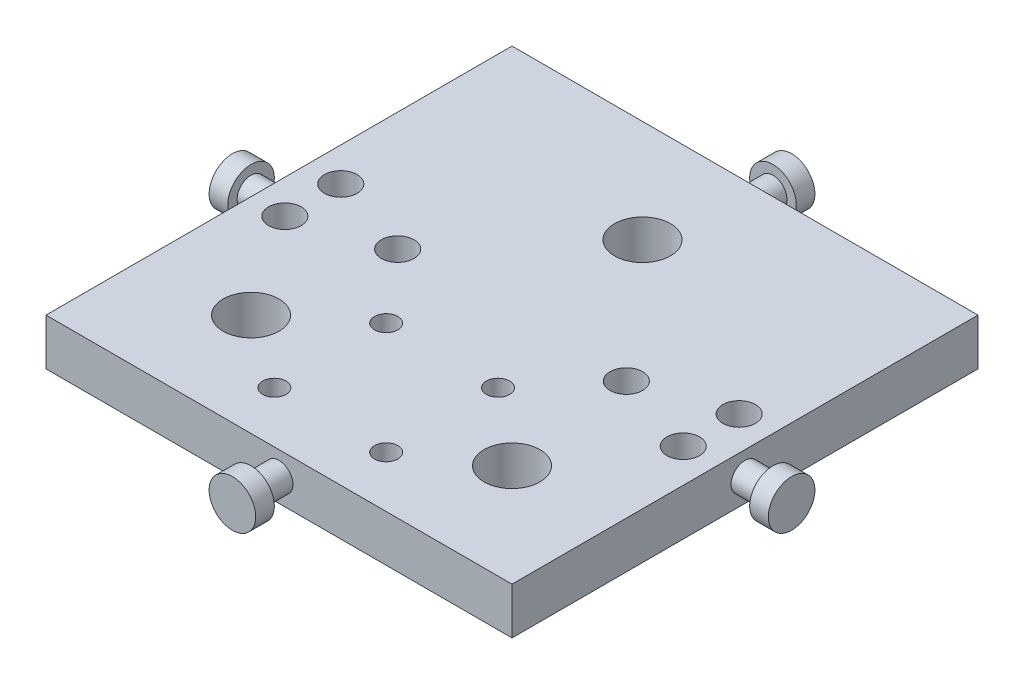
from build123d import *

# Parameters (mm, degrees)
SKETCH_1_W          = 50
SKETCH_1_H          = 50
EXTRUDE_1_DEPTH     = 5
SKETCH_2_R          = 3
CUT_EXTRUDE_1_DEPTH = 71.887234394
SKETCH_3_R          = 1.25
CUT_EXTRUDE_2_DEPTH = 71.887234394
SKETCH_8_R          = 1.75
CUT_EXTRUDE_4_DEPTH = 71.887234394
SKETCH_9_R          = 2.5
EXTRUDE_2_DEPTH     = 5
SKETCH_10_R         = 2.5
SKETCH_10_R_2       = 1.5
CUT_EXTRUDE_5_DEPTH = 3
SKETCH_11_R         = 2.5
EXTRUDE_3_DEPTH     = 5
SKETCH_12_R         = 2.5
SKETCH_12_R_2       = 1.5
CUT_EXTRUDE_7_DEPTH = 3


with BuildPart() as part:
    # 草图1 → 凸台-拉伸1 (new body)
    with BuildSketch(Plane(origin=(0, 0, 0), x_dir=(1, 0, 0), z_dir=(0, 1, 0))):
        with Locations((25, 25)):
            Rectangle(SKETCH_1_W, SKETCH_1_H)
    extrude(amount=EXTRUDE_1_DEPTH)

    # 草图2 → 切除-拉伸1 (cut, through all)
    with BuildSketch(Plane(origin=(0, 5, 0), x_dir=(1, 0, 0), z_dir=(0, 1, 0))):
        with Locations(Location((25, 39, 0), (0, 0, 270))):
            Circle(SKETCH_2_R)
        with Locations(Location((11, 11, 0), (0, 0, 270))):
            Circle(SKETCH_2_R)
        with Locations(Location((39, 11, 0), (0, 0, 270))):
            Circle(SKETCH_2_R)
    extrude(amount=-CUT_EXTRUDE_1_DEPTH, mode=Mode.SUBTRACT)

    # 草图3 → 切除-拉伸2 (cut, through all)
    with BuildSketch(Plane(origin=(0, 5, 0), x_dir=(1, 0, 0), z_dir=(0, 1, 0))):
        with Locations(Location((19, 17.5, 0), (0, 0, 270))):
            Circle(SKETCH_3_R)
        with Locations(Location((31, 17.5, 0), (0, 0, 270))):
            Circle(SKETCH_3_R)
        with Locations(Location((19, 5.5, 0), (0, 0, 270))):
            Circle(SKETCH_3_R)
        with Locations(Location((31, 5.5, 0), (0, 0, 270))):
            Circle(SKETCH_3_R)
    extrude(amount=-CUT_EXTRUDE_2_DEPTH, mode=Mode.SUBTRACT)

    # 草图8 → 切除-拉伸4 (cut, through all)
    with BuildSketch(Plane.XZ):
        with Locations(Location((46.372516673, -22, 0), (0, 0, 270))):
            Circle(SKETCH_8_R)
        with Locations(Location((46.372516673, -28, 0), (0, 0, 270))):
            Circle(SKETCH_8_R)
        with Locations(Location((37.264513071, -25, 0), (0, 0, 270))):
            Circle(SKETCH_8_R)
        with Locations(Location((12.735486929, -25, 0), (0, 0, 270))):
            Circle(SKETCH_8_R)
        with Locations(Location((3.627483327, -28, 0), (0, 0, 270))):
            Circle(SKETCH_8_R)
        with Locations(Location((3.627483327, -22, 0), (0, 0, 270))):
            Circle(SKETCH_8_R)
    extrude(amount=-CUT_EXTRUDE_4_DEPTH, mode=Mode.SUBTRACT)

    # 草图9 → 凸台-拉伸2 (add)
    with BuildSketch(Plane.XY):
        with Locations(Location((25, 2.5, 0), (0, 0, 270))):
            Circle(SKETCH_9_R)
    extrude_2 = extrude(amount=EXTRUDE_2_DEPTH)

    # 草图10 → 切除-拉伸5 (cut)
    with BuildSketch(Plane.XY):
        with Locations((25, 2.5)):
            Circle(SKETCH_10_R)
        with Locations((25, 2.5)):
            Circle(SKETCH_10_R_2, mode=Mode.SUBTRACT)
    cut_extrude_5 = extrude(amount=CUT_EXTRUDE_5_DEPTH, mode=Mode.SUBTRACT)

    # 草图11 → 凸台-拉伸3 (add)
    with BuildSketch(Plane(origin=(50, 0, 0), x_dir=(0, 0, -1), z_dir=(1, 0, 0))):
        with Locations(Location((25, 2.5, 0), (0, 0, 270))):
            Circle(SKETCH_11_R)
    extrude_3 = extrude(amount=EXTRUDE_3_DEPTH)

    # 草图12 → 切除-拉伸7 (cut)
    with BuildSketch(Plane(origin=(50, 0, 0), x_dir=(0, 0, -1), z_dir=(1, 0, 0))):
        with Locations((25, 2.5)):
            Circle(SKETCH_12_R)
        with Locations((25, 2.5)):
            Circle(SKETCH_12_R_2, mode=Mode.SUBTRACT)
    cut_extrude_7 = extrude(amount=CUT_EXTRUDE_7_DEPTH, mode=Mode.SUBTRACT)

    # 镜向1: 凸台-拉伸3, 切除-拉伸7 across plane
    add(extrude_3.mirror(Plane.ZY.offset(-25)))
    add(cut_extrude_7.mirror(Plane.ZY.offset(-25)), mode=Mode.SUBTRACT)

    # 镜向2: 凸台-拉伸2, 切除-拉伸5 across plane
    add(extrude_2.mirror(Plane(origin=(0, 0, -25), x_dir=(1, 0, 0), z_dir=(0, 0, -1))))
    add(cut_extrude_5.mirror(Plane(origin=(0, 0, -25), x_dir=(1, 0, 0), z_dir=(0, 0, -1))), mode=Mode.SUBTRACT)


solid = part.part
